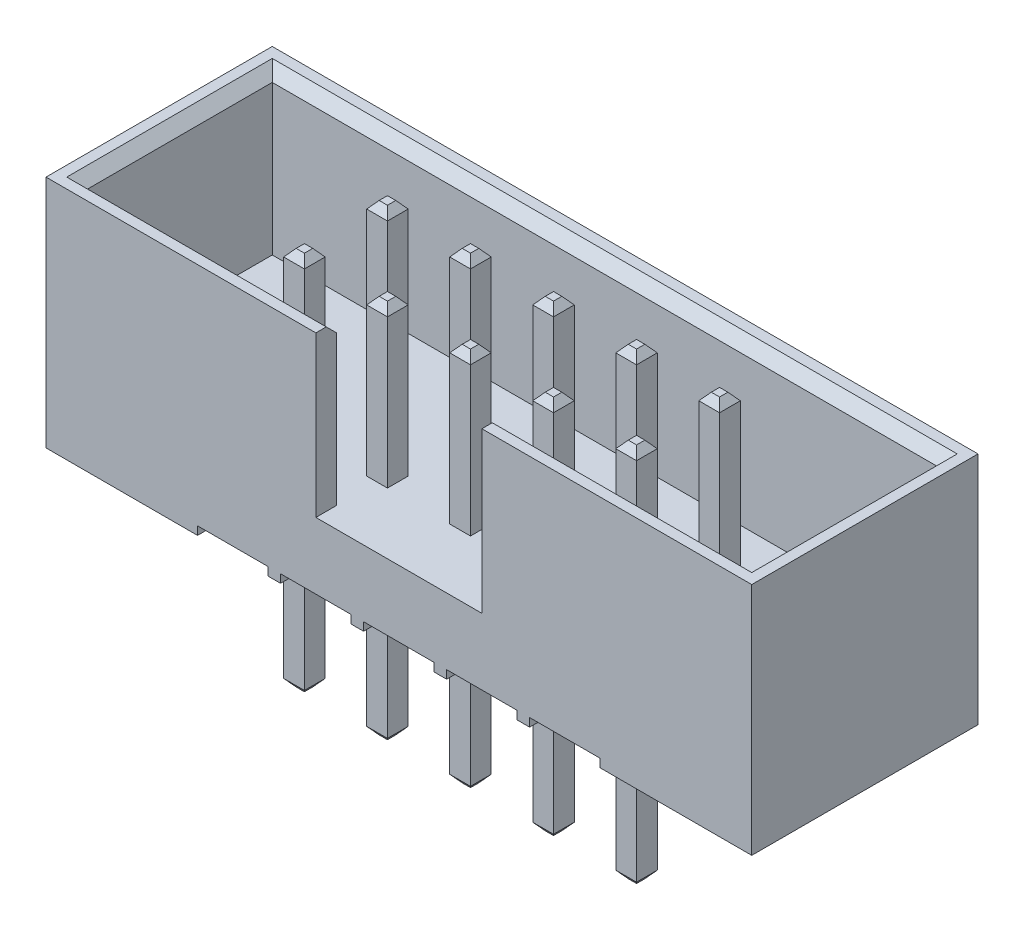
from build123d import *
from OCP.BRepFilletAPI import BRepFilletAPI_MakeChamfer

# Parameters (mm, degrees)
SKETCH_1_W                             = 17
SKETCH_1_H                             = 5.45
EXTRUDE_3455_DEPTH                     = 5.65
SKETCH_6_W                             = 1.7
SKETCH_6_H                             = 0.2
CUT_EXTRUDE_7_DEPTH                    = 19.724983311
PATTERN_LINEAR_3_COUNT                 = 5
PATTERN_LINEAR_3_PITCH                 = 2
SKETCH_2_W                             = 16
SKETCH_2_H                             = 4.45
CUT_EXTRUDE_2_DEPTH                    = 3.85
CUT_EXTRUDE_3_REACH                    = 20.725
SKETCH_3_W                             = 4
SKETCH_3_H                             = 3.85
SKETCH_5_W                             = 0.5
SKETCH_5_H                             = 0.5
EXTRUDE_5070_DEPTH                     = 9.15
CHAMFER_5153_SIZE                      = 0.25
CHAMFER_5474_SIZE                      = 0.15
CHAMFER_5474_SIZE2                     = 0.178763039
PATTERN_LINEAR_2_COUNT                 = 5
PATTERN_LINEAR_2_PITCH                 = 2
CHAMFER_5474_OF_PATTERN_LINEAR_2_SIZE  = 0.15
CHAMFER_5474_OF_PATTERN_LINEAR_2_SIZE2 = 0.178763039


with BuildPart() as part:
    # Эскиз1 → Extrude 3455 (new body)
    with BuildSketch(Plane(origin=(0, 0, 0), x_dir=(1, 0, 0), z_dir=(0, 1, 0))):
        with Locations((8.5, 2.725)):
            Rectangle(SKETCH_1_W, SKETCH_1_H)
    extrude(amount=EXTRUDE_3455_DEPTH)

    # Эскиз6 → Вырез-Вытянуть7 (cut, through all)
    with BuildSketch(Plane.XY):
        with Locations((4.5, 0.1)):
            Rectangle(SKETCH_6_W, SKETCH_6_H)
    cut_extrude_7 = extrude(amount=-CUT_EXTRUDE_7_DEPTH, mode=Mode.SUBTRACT)

    # Линейный массив3: Вырез-Вытянуть7 ×5
    with Locations(*[(i * PATTERN_LINEAR_3_PITCH, 0, 0) for i in range(1, PATTERN_LINEAR_3_COUNT)]):
        add(cut_extrude_7, mode=Mode.SUBTRACT)

    # Эскиз2 → Вырез-Вытянуть2 (cut)
    with BuildSketch(Plane(origin=(0, 5.65, 0), x_dir=(1, 0, 0), z_dir=(0, 1, 0))):
        with Locations((8.5, 2.725)):
            Rectangle(SKETCH_2_W, SKETCH_2_H)
    extrude(amount=-CUT_EXTRUDE_2_DEPTH, mode=Mode.SUBTRACT)

    # Эскиз3 → Вырез-Вытянуть3 (cut, up to next)
    with BuildSketch(Plane.XY, mode=Mode.PRIVATE) as cut_extrude_3_sk1:
        with Locations((8.5, 3.725)):
            Rectangle(SKETCH_3_W, SKETCH_3_H)
    cut_extrude_3_tool1 = extrude(cut_extrude_3_sk1.sketch, amount=-CUT_EXTRUDE_3_REACH, mode=Mode.PRIVATE) & part.part
    add(cut_extrude_3_tool1.solids().sort_by_distance((8.5, 3.725, 0))[0], mode=Mode.SUBTRACT)

    # Эскиз5 → Extrude 5070 (add)
    with BuildSketch(Plane(origin=(0, -3.6, 0), x_dir=(1, 0, 0), z_dir=(0, 1, 0))):
        with Locations((4.5, 1.725)):
            Rectangle(SKETCH_5_W, SKETCH_5_H)
        with Locations((4.5, 3.725)):
            Rectangle(SKETCH_5_W, SKETCH_5_H)
    extrude_5070 = extrude(amount=EXTRUDE_5070_DEPTH)

    # Chamfer 5153
    chamfer_5153_edges = [part.edges().sort_by_distance(p)[0] for p in [
        (13.5, 5.65, -0.5),
        (0.5, 5.65, -2.725),
        (3.5, 5.65, -0.5),
        (16.5, 5.65, -2.725),
        (8.5, 5.65, -4.95),
    ]]
    chamfer(chamfer_5153_edges, length=CHAMFER_5153_SIZE)

    # Chamfer 5474: one chamfer whose edges measure the first distance from different faces: ONE call of the kernel's chamfer builder (chamfer() names one face for all edges)
    chamfer_5474_edges_1 = [part.edges().sort_by_distance(p)[0] for p in [
        (4.5, -3.6, -1.475),
        (4.25, -3.6, -1.725),
        (4.5, -3.6, -1.975),
        (4.75, -3.6, -1.725),
    ]]
    chamfer_5474_side_1 = [part.faces().sort_by_distance(p)[0] for p in [
        (4.5, -3.6, -1.725),
    ]]
    chamfer_5474_edges_2 = [part.edges().sort_by_distance(p)[0] for p in [
        (4.5, 5.55, -1.475),
        (4.25, 5.55, -1.725),
        (4.5, 5.55, -1.975),
        (4.75, 5.55, -1.725),
    ]]
    chamfer_5474_side_2 = [part.faces().sort_by_distance(p)[0] for p in [
        (4.5, 5.55, -1.725),
    ]]
    chamfer_5474_edges_3 = [part.edges().sort_by_distance(p)[0] for p in [
        (4.5, -3.6, -3.475),
        (4.25, -3.6, -3.725),
        (4.5, -3.6, -3.975),
        (4.75, -3.6, -3.725),
    ]]
    chamfer_5474_side_3 = [part.faces().sort_by_distance(p)[0] for p in [
        (4.5, -3.6, -3.725),
    ]]
    chamfer_5474_edges_4 = [part.edges().sort_by_distance(p)[0] for p in [
        (4.5, 5.55, -3.475),
        (4.25, 5.55, -3.725),
        (4.5, 5.55, -3.975),
        (4.75, 5.55, -3.725),
    ]]
    chamfer_5474_side_4 = [part.faces().sort_by_distance(p)[0] for p in [
        (4.5, 5.55, -3.725),
    ]]
    chamfer_5474 = BRepFilletAPI_MakeChamfer(part.part.solid().wrapped)
    for e in chamfer_5474_edges_1:
        chamfer_5474.Add(CHAMFER_5474_SIZE, CHAMFER_5474_SIZE2, e.wrapped, chamfer_5474_side_1[0].wrapped)  # the first distance lies on this face
    for e in chamfer_5474_edges_2:
        chamfer_5474.Add(CHAMFER_5474_SIZE, CHAMFER_5474_SIZE2, e.wrapped, chamfer_5474_side_2[0].wrapped)  # the first distance lies on this face
    for e in chamfer_5474_edges_3:
        chamfer_5474.Add(CHAMFER_5474_SIZE, CHAMFER_5474_SIZE2, e.wrapped, chamfer_5474_side_3[0].wrapped)  # the first distance lies on this face
    for e in chamfer_5474_edges_4:
        chamfer_5474.Add(CHAMFER_5474_SIZE, CHAMFER_5474_SIZE2, e.wrapped, chamfer_5474_side_4[0].wrapped)  # the first distance lies on this face
    add(Compound.cast(chamfer_5474.Shape()), mode=Mode.REPLACE)

    # Линейный массив2: Extrude 5070 ×5
    with Locations(*[(i * PATTERN_LINEAR_2_PITCH, 0, 0) for i in range(1, PATTERN_LINEAR_2_COUNT)]):
        add(extrude_5070)

    # Chamfer 5474 of Линейный массив2: one chamfer whose edges measure the first distance from different faces: ONE call of the kernel's chamfer builder (chamfer() names one face for all edges)
    chamfer_5474_of_pattern_linear_2_edges_1 = [part.edges().sort_by_distance(p)[0] for p in [
        (6.5, -3.6, -1.475),
        (6.25, -3.6, -1.725),
        (6.5, -3.6, -1.975),
        (6.75, -3.6, -1.725),
    ]]
    chamfer_5474_of_pattern_linear_2_side_1 = [part.faces().sort_by_distance(p)[0] for p in [
        (6.5, -3.6, -1.725),
    ]]
    chamfer_5474_of_pattern_linear_2_edges_2 = [part.edges().sort_by_distance(p)[0] for p in [
        (6.5, 5.55, -1.475),
        (6.25, 5.55, -1.725),
        (6.5, 5.55, -1.975),
        (6.75, 5.55, -1.725),
    ]]
    chamfer_5474_of_pattern_linear_2_side_2 = [part.faces().sort_by_distance(p)[0] for p in [
        (6.5, 5.55, -1.725),
    ]]
    chamfer_5474_of_pattern_linear_2_edges_3 = [part.edges().sort_by_distance(p)[0] for p in [
        (6.5, -3.6, -3.475),
        (6.25, -3.6, -3.725),
        (6.5, -3.6, -3.975),
        (6.75, -3.6, -3.725),
    ]]
    chamfer_5474_of_pattern_linear_2_side_3 = [part.faces().sort_by_distance(p)[0] for p in [
        (6.5, -3.6, -3.725),
    ]]
    chamfer_5474_of_pattern_linear_2_edges_4 = [part.edges().sort_by_distance(p)[0] for p in [
        (6.5, 5.55, -3.475),
        (6.25, 5.55, -3.725),
        (6.5, 5.55, -3.975),
        (6.75, 5.55, -3.725),
    ]]
    chamfer_5474_of_pattern_linear_2_side_4 = [part.faces().sort_by_distance(p)[0] for p in [
        (6.5, 5.55, -3.725),
    ]]
    chamfer_5474_of_pattern_linear_2_edges_5 = [part.edges().sort_by_distance(p)[0] for p in [
        (8.5, -3.6, -1.475),
        (8.25, -3.6, -1.725),
        (8.5, -3.6, -1.975),
        (8.75, -3.6, -1.725),
    ]]
    chamfer_5474_of_pattern_linear_2_side_5 = [part.faces().sort_by_distance(p)[0] for p in [
        (8.5, -3.6, -1.725),
    ]]
    chamfer_5474_of_pattern_linear_2_edges_6 = [part.edges().sort_by_distance(p)[0] for p in [
        (8.5, 5.55, -1.475),
        (8.25, 5.55, -1.725),
        (8.5, 5.55, -1.975),
        (8.75, 5.55, -1.725),
    ]]
    chamfer_5474_of_pattern_linear_2_side_6 = [part.faces().sort_by_distance(p)[0] for p in [
        (8.5, 5.55, -1.725),
    ]]
    chamfer_5474_of_pattern_linear_2_edges_7 = [part.edges().sort_by_distance(p)[0] for p in [
        (8.5, -3.6, -3.475),
        (8.25, -3.6, -3.725),
        (8.5, -3.6, -3.975),
        (8.75, -3.6, -3.725),
    ]]
    chamfer_5474_of_pattern_linear_2_side_7 = [part.faces().sort_by_distance(p)[0] for p in [
        (8.5, -3.6, -3.725),
    ]]
    chamfer_5474_of_pattern_linear_2_edges_8 = [part.edges().sort_by_distance(p)[0] for p in [
        (8.5, 5.55, -3.475),
        (8.25, 5.55, -3.725),
        (8.5, 5.55, -3.975),
        (8.75, 5.55, -3.725),
    ]]
    chamfer_5474_of_pattern_linear_2_side_8 = [part.faces().sort_by_distance(p)[0] for p in [
        (8.5, 5.55, -3.725),
    ]]
    chamfer_5474_of_pattern_linear_2_edges_9 = [part.edges().sort_by_distance(p)[0] for p in [
        (10.5, -3.6, -1.475),
        (10.25, -3.6, -1.725),
        (10.5, -3.6, -1.975),
        (10.75, -3.6, -1.725),
    ]]
    chamfer_5474_of_pattern_linear_2_side_9 = [part.faces().sort_by_distance(p)[0] for p in [
        (10.5, -3.6, -1.725),
    ]]
    chamfer_5474_of_pattern_linear_2_edges_10 = [part.edges().sort_by_distance(p)[0] for p in [
        (10.5, 5.55, -1.475),
        (10.25, 5.55, -1.725),
        (10.5, 5.55, -1.975),
        (10.75, 5.55, -1.725),
    ]]
    chamfer_5474_of_pattern_linear_2_side_10 = [part.faces().sort_by_distance(p)[0] for p in [
        (10.5, 5.55, -1.725),
    ]]
    chamfer_5474_of_pattern_linear_2_edges_11 = [part.edges().sort_by_distance(p)[0] for p in [
        (10.5, -3.6, -3.475),
        (10.25, -3.6, -3.725),
        (10.5, -3.6, -3.975),
        (10.75, -3.6, -3.725),
    ]]
    chamfer_5474_of_pattern_linear_2_side_11 = [part.faces().sort_by_distance(p)[0] for p in [
        (10.5, -3.6, -3.725),
    ]]
    chamfer_5474_of_pattern_linear_2_edges_12 = [part.edges().sort_by_distance(p)[0] for p in [
        (10.5, 5.55, -3.475),
        (10.25, 5.55, -3.725),
        (10.5, 5.55, -3.975),
        (10.75, 5.55, -3.725),
    ]]
    chamfer_5474_of_pattern_linear_2_side_12 = [part.faces().sort_by_distance(p)[0] for p in [
        (10.5, 5.55, -3.725),
    ]]
    chamfer_5474_of_pattern_linear_2_edges_13 = [part.edges().sort_by_distance(p)[0] for p in [
        (12.5, -3.6, -1.475),
        (12.25, -3.6, -1.725),
        (12.5, -3.6, -1.975),
        (12.75, -3.6, -1.725),
    ]]
    chamfer_5474_of_pattern_linear_2_side_13 = [part.faces().sort_by_distance(p)[0] for p in [
        (12.5, -3.6, -1.725),
    ]]
    chamfer_5474_of_pattern_linear_2_edges_14 = [part.edges().sort_by_distance(p)[0] for p in [
        (12.5, 5.55, -1.475),
        (12.25, 5.55, -1.725),
        (12.5, 5.55, -1.975),
        (12.75, 5.55, -1.725),
    ]]
    chamfer_5474_of_pattern_linear_2_side_14 = [part.faces().sort_by_distance(p)[0] for p in [
        (12.5, 5.55, -1.725),
    ]]
    chamfer_5474_of_pattern_linear_2_edges_15 = [part.edges().sort_by_distance(p)[0] for p in [
        (12.5, -3.6, -3.475),
        (12.25, -3.6, -3.725),
        (12.5, -3.6, -3.975),
        (12.75, -3.6, -3.725),
    ]]
    chamfer_5474_of_pattern_linear_2_side_15 = [part.faces().sort_by_distance(p)[0] for p in [
        (12.5, -3.6, -3.725),
    ]]
    chamfer_5474_of_pattern_linear_2_edges_16 = [part.edges().sort_by_distance(p)[0] for p in [
        (12.5, 5.55, -3.475),
        (12.25, 5.55, -3.725),
        (12.5, 5.55, -3.975),
        (12.75, 5.55, -3.725),
    ]]
    chamfer_5474_of_pattern_linear_2_side_16 = [part.faces().sort_by_distance(p)[0] for p in [
        (12.5, 5.55, -3.725),
    ]]
    chamfer_5474_of_pattern_linear_2 = BRepFilletAPI_MakeChamfer(part.part.solid().wrapped)
    for e in chamfer_5474_of_pattern_linear_2_edges_1:
        chamfer_5474_of_pattern_linear_2.Add(CHAMFER_5474_OF_PATTERN_LINEAR_2_SIZE, CHAMFER_5474_OF_PATTERN_LINEAR_2_SIZE2, e.wrapped, chamfer_5474_of_pattern_linear_2_side_1[0].wrapped)  # the first distance lies on this face
    for e in chamfer_5474_of_pattern_linear_2_edges_2:
        chamfer_5474_of_pattern_linear_2.Add(CHAMFER_5474_OF_PATTERN_LINEAR_2_SIZE, CHAMFER_5474_OF_PATTERN_LINEAR_2_SIZE2, e.wrapped, chamfer_5474_of_pattern_linear_2_side_2[0].wrapped)  # the first distance lies on this face
    for e in chamfer_5474_of_pattern_linear_2_edges_3:
        chamfer_5474_of_pattern_linear_2.Add(CHAMFER_5474_OF_PATTERN_LINEAR_2_SIZE, CHAMFER_5474_OF_PATTERN_LINEAR_2_SIZE2, e.wrapped, chamfer_5474_of_pattern_linear_2_side_3[0].wrapped)  # the first distance lies on this face
    for e in chamfer_5474_of_pattern_linear_2_edges_4:
        chamfer_5474_of_pattern_linear_2.Add(CHAMFER_5474_OF_PATTERN_LINEAR_2_SIZE, CHAMFER_5474_OF_PATTERN_LINEAR_2_SIZE2, e.wrapped, chamfer_5474_of_pattern_linear_2_side_4[0].wrapped)  # the first distance lies on this face
    for e in chamfer_5474_of_pattern_linear_2_edges_5:
        chamfer_5474_of_pattern_linear_2.Add(CHAMFER_5474_OF_PATTERN_LINEAR_2_SIZE, CHAMFER_5474_OF_PATTERN_LINEAR_2_SIZE2, e.wrapped, chamfer_5474_of_pattern_linear_2_side_5[0].wrapped)  # the first distance lies on this face
    for e in chamfer_5474_of_pattern_linear_2_edges_6:
        chamfer_5474_of_pattern_linear_2.Add(CHAMFER_5474_OF_PATTERN_LINEAR_2_SIZE, CHAMFER_5474_OF_PATTERN_LINEAR_2_SIZE2, e.wrapped, chamfer_5474_of_pattern_linear_2_side_6[0].wrapped)  # the first distance lies on this face
    for e in chamfer_5474_of_pattern_linear_2_edges_7:
        chamfer_5474_of_pattern_linear_2.Add(CHAMFER_5474_OF_PATTERN_LINEAR_2_SIZE, CHAMFER_5474_OF_PATTERN_LINEAR_2_SIZE2, e.wrapped, chamfer_5474_of_pattern_linear_2_side_7[0].wrapped)  # the first distance lies on this face
    for e in chamfer_5474_of_pattern_linear_2_edges_8:
        chamfer_5474_of_pattern_linear_2.Add(CHAMFER_5474_OF_PATTERN_LINEAR_2_SIZE, CHAMFER_5474_OF_PATTERN_LINEAR_2_SIZE2, e.wrapped, chamfer_5474_of_pattern_linear_2_side_8[0].wrapped)  # the first distance lies on this face
    for e in chamfer_5474_of_pattern_linear_2_edges_9:
        chamfer_5474_of_pattern_linear_2.Add(CHAMFER_5474_OF_PATTERN_LINEAR_2_SIZE, CHAMFER_5474_OF_PATTERN_LINEAR_2_SIZE2, e.wrapped, chamfer_5474_of_pattern_linear_2_side_9[0].wrapped)  # the first distance lies on this face
    for e in chamfer_5474_of_pattern_linear_2_edges_10:
        chamfer_5474_of_pattern_linear_2.Add(CHAMFER_5474_OF_PATTERN_LINEAR_2_SIZE, CHAMFER_5474_OF_PATTERN_LINEAR_2_SIZE2, e.wrapped, chamfer_5474_of_pattern_linear_2_side_10[0].wrapped)  # the first distance lies on this face
    for e in chamfer_5474_of_pattern_linear_2_edges_11:
        chamfer_5474_of_pattern_linear_2.Add(CHAMFER_5474_OF_PATTERN_LINEAR_2_SIZE, CHAMFER_5474_OF_PATTERN_LINEAR_2_SIZE2, e.wrapped, chamfer_5474_of_pattern_linear_2_side_11[0].wrapped)  # the first distance lies on this face
    for e in chamfer_5474_of_pattern_linear_2_edges_12:
        chamfer_5474_of_pattern_linear_2.Add(CHAMFER_5474_OF_PATTERN_LINEAR_2_SIZE, CHAMFER_5474_OF_PATTERN_LINEAR_2_SIZE2, e.wrapped, chamfer_5474_of_pattern_linear_2_side_12[0].wrapped)  # the first distance lies on this face
    for e in chamfer_5474_of_pattern_linear_2_edges_13:
        chamfer_5474_of_pattern_linear_2.Add(CHAMFER_5474_OF_PATTERN_LINEAR_2_SIZE, CHAMFER_5474_OF_PATTERN_LINEAR_2_SIZE2, e.wrapped, chamfer_5474_of_pattern_linear_2_side_13[0].wrapped)  # the first distance lies on this face
    for e in chamfer_5474_of_pattern_linear_2_edges_14:
        chamfer_5474_of_pattern_linear_2.Add(CHAMFER_5474_OF_PATTERN_LINEAR_2_SIZE, CHAMFER_5474_OF_PATTERN_LINEAR_2_SIZE2, e.wrapped, chamfer_5474_of_pattern_linear_2_side_14[0].wrapped)  # the first distance lies on this face
    for e in chamfer_5474_of_pattern_linear_2_edges_15:
        chamfer_5474_of_pattern_linear_2.Add(CHAMFER_5474_OF_PATTERN_LINEAR_2_SIZE, CHAMFER_5474_OF_PATTERN_LINEAR_2_SIZE2, e.wrapped, chamfer_5474_of_pattern_linear_2_side_15[0].wrapped)  # the first distance lies on this face
    for e in chamfer_5474_of_pattern_linear_2_edges_16:
        chamfer_5474_of_pattern_linear_2.Add(CHAMFER_5474_OF_PATTERN_LINEAR_2_SIZE, CHAMFER_5474_OF_PATTERN_LINEAR_2_SIZE2, e.wrapped, chamfer_5474_of_pattern_linear_2_side_16[0].wrapped)  # the first distance lies on this face
    add(Compound.cast(chamfer_5474_of_pattern_linear_2.Shape()), mode=Mode.REPLACE)


solid = part.part
